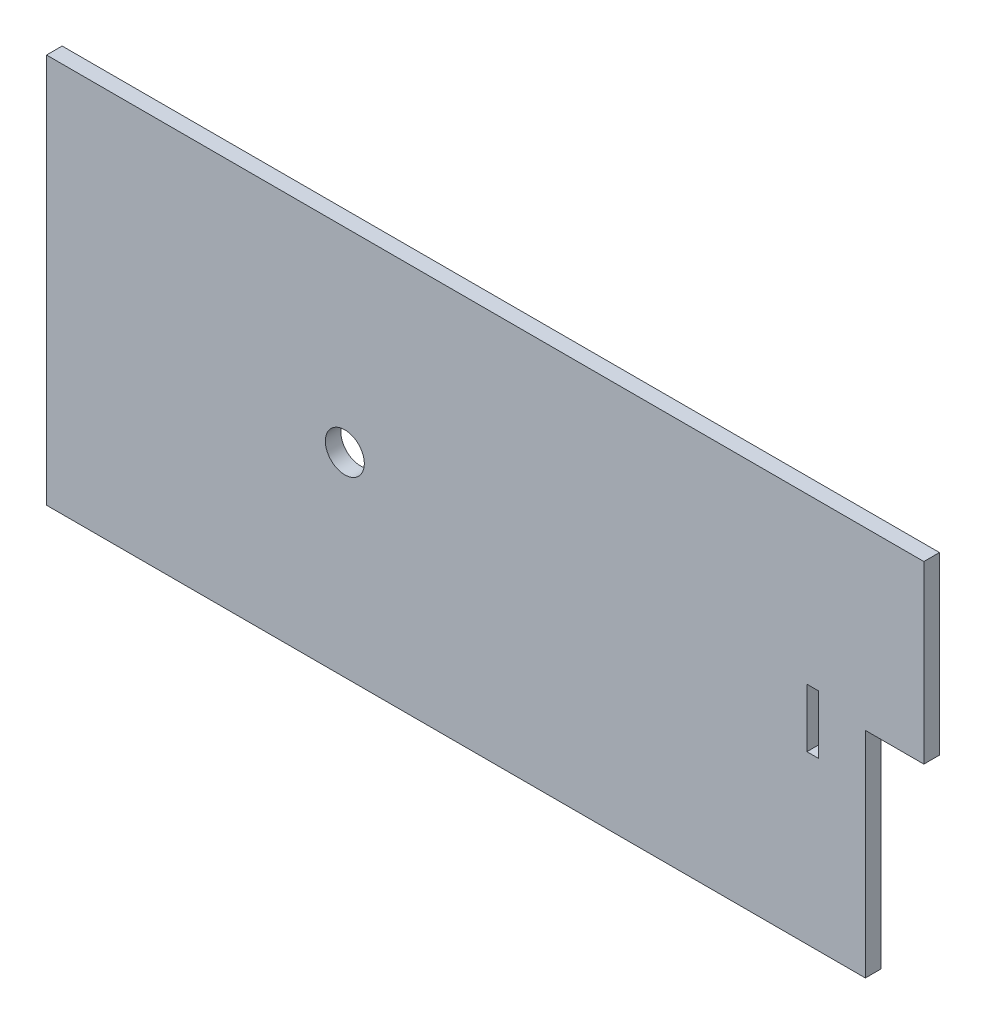
from build123d import *

# Parameters (mm, degrees)
SKETCH1_R           = 5
SKETCH1_W           = 3
SKETCH1_H           = 15
BOSS_EXTRUDE1_DEPTH = 4


with BuildPart() as part:
    # Sketch1 → Boss-Extrude1 (new body)
    with BuildSketch(Plane.XY):
        Polygon((60, 50), (75, 50), (75, 5), (60, 5), (60, -50), (-150, -50), (-150, 50), align=None)
        with Locations((-73.5, 0)):
            Circle(SKETCH1_R, mode=Mode.SUBTRACT)
        with Locations((46.5, 0.26206532)):
            Rectangle(SKETCH1_W, SKETCH1_H, mode=Mode.SUBTRACT)
    extrude(amount=BOSS_EXTRUDE1_DEPTH)


solid = part.part
